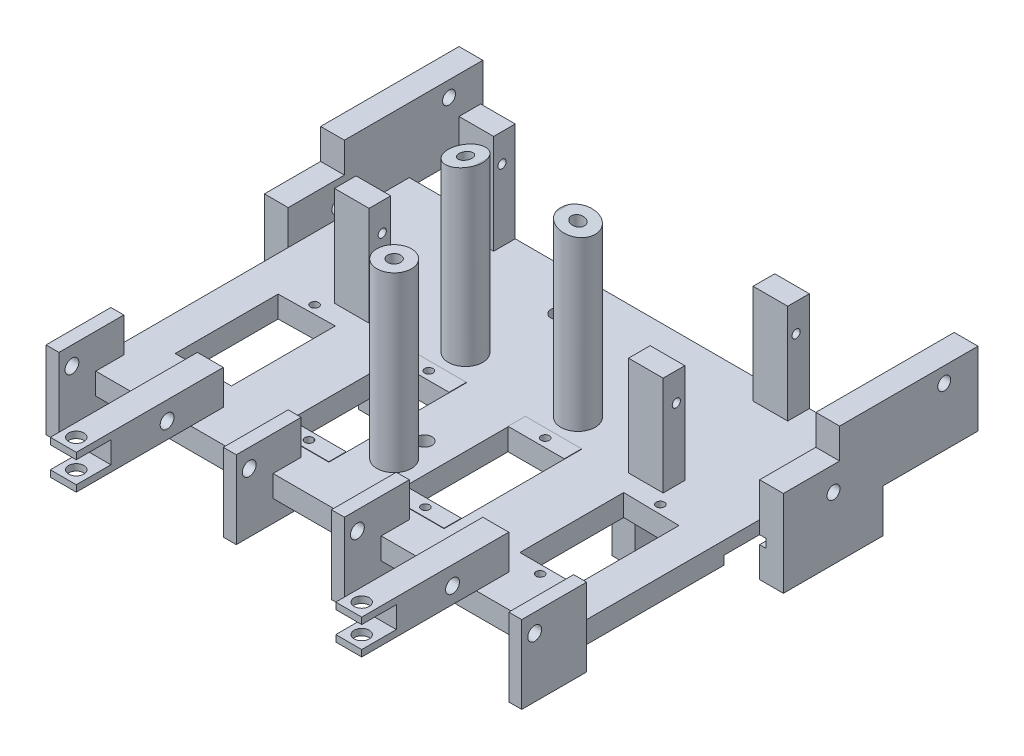
from build123d import *

# Parameters (mm, degrees)
SKETCH_1_W           = 109
SKETCH_1_H           = 75
EXTRUDE_1_DEPTH      = 5
SKETCH_4_W           = 105
SKETCH_4_H           = 28
EXTRUDE_4_DEPTH      = 5
SKETCH_5_W           = 23
SKETCH_5_H           = 20
EXTRUDE_5_DEPTH      = 5.5
SKETCH_6_W           = 32
SKETCH_6_H           = 17
EXTRUDE_6_DEPTH      = 5.5
SKETCH_8_W           = 8
SKETCH_8_H           = 5
EXTRUDE_7_DEPTH      = 23
EXTRUDE_START        = -10
SKETCH_9_W           = 3
SKETCH_9_H           = 15
EXTRUDE_8_DEPTH      = 18
SKETCH_10_W          = 3
SKETCH_10_H          = 15
EXTRUDE_9_DEPTH      = 18
SKETCH_11_W          = 6
SKETCH_11_H          = 34
EXTRUDE_10_DEPTH     = 8
SKETCH_12_R          = 4
EXTRUDE_11_DEPTH     = 40
CUT_EXTRUDE_8_REACH  = 123.15
SKETCH_19_R          = 0.95
SKETCH_25_R          = 4
EXTRUDE_14_DEPTH     = 40
CUT_EXTRUDE_14_DEPTH = 36
SKETCH_28_W          = 6
SKETCH_28_H          = 5
CUT_EXTRUDE_16_DEPTH = 8
SKETCH_29_R          = 1.75
CUT_EXTRUDE_17_DEPTH = 8
SKETCH_30_R          = 1.6
CUT_EXTRUDE_18_DEPTH = 48
SKETCH_31_R          = 1.75
CUT_EXTRUDE_19_DEPTH = 20
SKETCH_35_R          = 1.5
CUT_EXTRUDE_23_DEPTH = 15
SKETCH_36_R          = 0.95
SKETCH_36_W          = 13
SKETCH_36_H          = 23.8
CUT_EXTRUDE_24_DEPTH = 7
SKETCH_37_W          = 6
SKETCH_37_H          = 5
SKETCH_37_W_2        = 5.306431403
EXTRUDE_15_DEPTH     = 13
SKETCH_38_R          = 0.95
CUT_EXTRUDE_25_DEPTH = 13
SKETCH_43_W          = 37.306431403
SKETCH_43_H          = 36.277028663
SKETCH_43_W_2        = 5.306431403
SKETCH_43_H_2        = 5
SKETCH_43_W_3        = 6
CUT_EXTRUDE_28_DEPTH = 2
EXTRUDE_START_2      = 0.1
SKETCH_41_W          = 13
SKETCH_41_H          = 4
SKETCH_41_R          = 0.95
EXTRUDE_16_DEPTH     = 0.1
CUT_EXTRUDE_START    = -13
SKETCH_39_R          = 1.5
CUT_EXTRUDE_26_DEPTH = 55


with BuildPart() as part:
    # 草图1 → 凸台-拉伸1 (new body)
    with BuildSketch(Plane(origin=(0, 0, 0), x_dir=(1, 0, 0), z_dir=(0, 1, 0))):
        Rectangle(SKETCH_1_W, SKETCH_1_H)
    extrude(amount=EXTRUDE_1_DEPTH)

    # 草图4 → 凸台-拉伸4 (add)
    with BuildSketch(Plane(origin=(0, 5, 0), x_dir=(1, 0, 0), z_dir=(0, 1, 0))):
        with Locations((0, 23.5)):
            Rectangle(SKETCH_4_W, SKETCH_4_H)
    extrude(amount=-EXTRUDE_4_DEPTH)

    # 草图5 → 凸台-拉伸5 (add)
    with BuildSketch(Plane.ZY.offset(54.5)):
        with Locations((-21, 3)):
            Rectangle(SKETCH_5_W, SKETCH_5_H)
    extrude_5 = extrude(amount=EXTRUDE_5_DEPTH)

    # 草图6 → 凸台-拉伸6 (add)
    with BuildSketch(Plane.ZY.offset(54.5)):
        with Locations((-38.5, 11.5)):
            Rectangle(SKETCH_6_W, SKETCH_6_H)
    extrude_6 = extrude(amount=EXTRUDE_6_DEPTH)

    # 草图8 → 凸台-拉伸7 (add)
    with BuildSketch(Plane(origin=(0, 5, 0), x_dir=(1, 0, 0), z_dir=(0, 1, 0))):
        with Locations((-34, 35)):
            Rectangle(SKETCH_8_W, SKETCH_8_H)
        with Locations((-34, 6.2)):
            Rectangle(SKETCH_8_W, SKETCH_8_H)
    extrude_7 = extrude(amount=EXTRUDE_7_DEPTH)

    # 草图9 → 凸台-拉伸8 (add)
    with BuildSketch(Plane(origin=(0, 5, 0), x_dir=(1, 0, 0), z_dir=(0, 1, 0)).offset(EXTRUDE_START)):
        with Locations((-12.5, -38.5)):
            Rectangle(SKETCH_9_W, SKETCH_9_H)
    extrude_8 = extrude(amount=EXTRUDE_8_DEPTH)

    # 草图10 → 凸台-拉伸9 (add)
    with BuildSketch(Plane(origin=(0, 5, 0), x_dir=(1, 0, 0), z_dir=(0, 1, 0)).offset(EXTRUDE_START)):
        with Locations((-53.5, -38.5)):
            Rectangle(SKETCH_10_W, SKETCH_10_H)
    extrude_9 = extrude(amount=EXTRUDE_9_DEPTH)

    # 草图11 → 凸台-拉伸10 (add)
    with BuildSketch(Plane(origin=(0, 5, 0), x_dir=(1, 0, 0), z_dir=(0, 1, 0))):
        with Locations((-33, -47)):
            Rectangle(SKETCH_11_W, SKETCH_11_H)
    extrude_10 = extrude(amount=EXTRUDE_10_DEPTH)

    # 草图12 → 凸台-拉伸11 (add)
    with BuildSketch(Plane(origin=(0, 5, 0), x_dir=(1, 0, 0), z_dir=(0, 1, 0))):
        with Locations(Location((-13, 9, 0), (0, 0, 270))):
            Circle(SKETCH_12_R)
    extrude_11 = extrude(amount=EXTRUDE_11_DEPTH)

    # 草图19 → 切除-拉伸8 (cut, up to next)
    with BuildSketch(Plane.ZY.offset(38), mode=Mode.PRIVATE) as cut_extrude_8_sk1:
        with Locations((-6.75, 21.5)):
            Circle(SKETCH_19_R)
    cut_extrude_8_tool1 = extrude(cut_extrude_8_sk1.sketch, amount=-CUT_EXTRUDE_8_REACH, mode=Mode.PRIVATE) & part.part
    # 草图19 → 切除-拉伸8 (cut, up to next)
    with BuildSketch(Plane.ZY.offset(38), mode=Mode.PRIVATE) as cut_extrude_8_sk2:
        with Locations((-34.45, 21.5)):
            Circle(SKETCH_19_R)
    cut_extrude_8_tool2 = extrude(cut_extrude_8_sk2.sketch, amount=-CUT_EXTRUDE_8_REACH, mode=Mode.PRIVATE) & part.part
    cut_extrude_8_1 = cut_extrude_8_tool1.solids().sort_by_distance((-38, 21.5, -6.75))[0]
    add(cut_extrude_8_1, mode=Mode.SUBTRACT)
    cut_extrude_8_2 = cut_extrude_8_tool2.solids().sort_by_distance((-38, 21.5, -34.45))[0]
    add(cut_extrude_8_2, mode=Mode.SUBTRACT)
    cut_extrude_8 = cut_extrude_8_1 + cut_extrude_8_2  # 切除-拉伸8 as one shape, for the pattern or mirror that repeats it

    # 草图25 → 凸台-拉伸14 (add)
    with BuildSketch(Plane(origin=(0, 5, 0), x_dir=(1, 0, 0), z_dir=(0, 1, 0))):
        with Locations(Location((0, -20.5, 0), (0, 0, 270))):
            Circle(SKETCH_25_R)
    extrude(amount=EXTRUDE_14_DEPTH)

    # 草图26 → 切除-拉伸14 (cut)
    with BuildSketch(Plane.XY):
        Polygon((-17, 45), (-17, 43.644045518), (-9.31, 45), align=None)
    cut_extrude_14 = extrude(amount=-CUT_EXTRUDE_14_DEPTH, mode=Mode.SUBTRACT)

    # 草图28 → 切除-拉伸16 (cut)
    with BuildSketch(Plane.XY.offset(64)):
        with Locations((-33, 9)):
            Rectangle(SKETCH_28_W, SKETCH_28_H)
    cut_extrude_16 = extrude(amount=-CUT_EXTRUDE_16_DEPTH, mode=Mode.SUBTRACT)

    # 草图29 → 切除-拉伸17 (cut)
    with BuildSketch(Plane(origin=(0, 13, 0), x_dir=(1, 0, 0), z_dir=(0, 1, 0))):
        with Locations(Location((-33, -61, 0), (0, 0, 270))):
            Circle(SKETCH_29_R)
    cut_extrude_17 = extrude(amount=-CUT_EXTRUDE_17_DEPTH, mode=Mode.SUBTRACT)

    # 草图30 → 切除-拉伸18 (cut)
    with BuildSketch(Plane.ZY.offset(55)):
        with Locations((43, 8.75)):
            Circle(SKETCH_30_R)
    cut_extrude_18 = extrude(amount=-CUT_EXTRUDE_18_DEPTH, mode=Mode.SUBTRACT)

    # 草图31 → 切除-拉伸19 (cut)
    with BuildSketch(Plane(origin=(0, 5, 0), x_dir=(1, 0, 0), z_dir=(0, 1, 0))):
        with Locations(Location((0, -13.5, 0), (0, 0, 270))):
            Circle(SKETCH_31_R)
        with Locations(Location((-10, 27.5, 0), (0, 0, 270))):
            Circle(SKETCH_31_R)
        with Locations(Location((10, 27.5, 0), (0, 0, 270))):
            Circle(SKETCH_31_R)
    extrude(amount=-CUT_EXTRUDE_19_DEPTH, mode=Mode.SUBTRACT)

    # 草图35 → 切除-拉伸23 (cut)
    with BuildSketch(Plane.ZY.offset(60)):
        with Locations((-46.688415906, 16.452713274)):
            Circle(SKETCH_35_R)
        with Locations((-21.089366767, 7.437765567)):
            Circle(SKETCH_35_R)
    cut_extrude_23 = extrude(amount=-CUT_EXTRUDE_23_DEPTH, mode=Mode.SUBTRACT)

    # 草图36 → 切除-拉伸24 (cut)
    with BuildSketch(Plane(origin=(0, 5, 0), x_dir=(1, 0, 0), z_dir=(0, 1, 0))):
        with Locations(Location((-13.450764078, 0.968101862, 0), (0, 0, 270))):
            Circle(SKETCH_36_R)
        with Locations(Location((-13.450764078, -26.731898138, 0), (0, 0, 270))):
            Circle(SKETCH_36_R)
        with Locations(Location((-39.980852572, -26.731898138, 0), (0, 0, 270))):
            Circle(SKETCH_36_R)
        with Locations(Location((-39.98003787, 1.073911603, 0), (0, 0, 270))):
            Circle(SKETCH_36_R)
        with Locations((-13.315810377, -12.881898138)):
            Rectangle(SKETCH_36_W, SKETCH_36_H)
        Polygon((-33.347062743, -0.766375386), (-33.347062743, -24.781898138), (-46.345897091, -24.781898138), (-46.345276079, -0.981898147), align=None)
    cut_extrude_24 = extrude(amount=-CUT_EXTRUDE_24_DEPTH, mode=Mode.SUBTRACT)

    # 草图37 → 凸台-拉伸15 (add)
    with BuildSketch(Plane.XZ):
        with Locations((-29.638562747, -34.522971337)):
            Rectangle(SKETCH_37_W, SKETCH_37_H)
        with Locations((-29.291778449, -5.722971337)):
            Rectangle(SKETCH_37_W_2, SKETCH_37_H)
    extrude_15 = extrude(amount=EXTRUDE_15_DEPTH)

    # 草图38 → 切除-拉伸25 (cut)
    with BuildSketch(Plane.ZY.offset(32.638562747)):
        with Locations((-33.972971337, -4.5)):
            Circle(SKETCH_38_R)
        with Locations((-6.272971337, -4.5)):
            Circle(SKETCH_38_R)
    cut_extrude_25 = extrude(amount=-CUT_EXTRUDE_25_DEPTH, mode=Mode.SUBTRACT)

    # 草图43 → 切除-拉伸28 (cut)
    with BuildSketch(Plane.XZ):
        with Locations((-37.291778449, -19.361485668)):
            Rectangle(SKETCH_43_W, SKETCH_43_H)
        with Locations((-29.291778449, -5.722971337)):
            Rectangle(SKETCH_43_W_2, SKETCH_43_H_2, mode=Mode.SUBTRACT)
        with Locations((-29.638562747, -34.522971337)):
            Rectangle(SKETCH_43_W_3, SKETCH_43_H_2, mode=Mode.SUBTRACT)
    cut_extrude_28 = extrude(amount=-CUT_EXTRUDE_28_DEPTH, mode=Mode.SUBTRACT)

    # 草图41 → 凸台-拉伸16 (add)
    # profile 1 of 2: a face of its own
    with BuildSketch(Plane(origin=(0, 5, 0), x_dir=(1, 0, 0), z_dir=(0, 1, 0)).offset(EXTRUDE_START_2)):
        with Locations((-13.315810377, 1.018101862)):
            Rectangle(SKETCH_41_W, SKETCH_41_H)
        with Locations(Location((-13.450764078, 0.968101862, 0), (0, 0, 270))):
            Circle(SKETCH_41_R, mode=Mode.SUBTRACT)
    # profile 2 of 2: a face of its own
    with BuildSketch(Plane(origin=(0, 5, 0), x_dir=(1, 0, 0), z_dir=(0, 1, 0)).offset(EXTRUDE_START_2)):
        with Locations((-13.315810377, -26.781898138)):
            Rectangle(SKETCH_41_W, SKETCH_41_H)
        with Locations(Location((-13.450764078, -26.731898138, 0), (0, 0, 270))):
            Circle(SKETCH_41_R, mode=Mode.SUBTRACT)
    extrude_16 = extrude(amount=-EXTRUDE_16_DEPTH)

    # 草图39 → 切除-拉伸26 (cut)
    with BuildSketch(Plane(origin=(0, 5, 0), x_dir=(1, 0, 0), z_dir=(0, 1, 0)).offset(CUT_EXTRUDE_START)):
        with Locations(Location((-13, 9, 0), (0, 0, 180))):
            Circle(SKETCH_39_R)
        with Locations(Location((0, -20.5, 0), (0, 0, 270))):
            Circle(SKETCH_39_R)
    cut_extrude_26 = extrude(amount=CUT_EXTRUDE_26_DEPTH, mode=Mode.SUBTRACT)

    # 镜向1: 凸台-拉伸5, 凸台-拉伸6, 凸台-拉伸7, 凸台-拉伸8, 凸台-拉伸9, 凸台-拉伸10, 凸台-拉伸11, 切除-拉伸8, 切除-拉伸14, 切除-拉伸16, 切除-拉伸17, 切除-拉伸18, 切除-拉伸23, 切除-拉伸24, 凸台-拉伸15, 切除-拉伸25, 切除-拉伸28, 凸台-拉伸16, 切除-拉伸26 across plane
    add(extrude_5.mirror(Plane(origin=(0, 0, 0), x_dir=(0, 0, 1), z_dir=(1, 0, 0))))
    add(extrude_6.mirror(Plane(origin=(0, 0, 0), x_dir=(0, 0, 1), z_dir=(1, 0, 0))))
    add(extrude_7.mirror(Plane(origin=(0, 0, 0), x_dir=(0, 0, 1), z_dir=(1, 0, 0))))
    add(extrude_8.mirror(Plane(origin=(0, 0, 0), x_dir=(0, 0, 1), z_dir=(1, 0, 0))))
    add(extrude_9.mirror(Plane(origin=(0, 0, 0), x_dir=(0, 0, 1), z_dir=(1, 0, 0))))
    add(extrude_10.mirror(Plane(origin=(0, 0, 0), x_dir=(0, 0, 1), z_dir=(1, 0, 0))))
    add(extrude_11.mirror(Plane(origin=(0, 0, 0), x_dir=(0, 0, 1), z_dir=(1, 0, 0))))
    add(cut_extrude_8.mirror(Plane(origin=(0, 0, 0), x_dir=(0, 0, 1), z_dir=(1, 0, 0))), mode=Mode.SUBTRACT)
    add(cut_extrude_14.mirror(Plane(origin=(0, 0, 0), x_dir=(0, 0, 1), z_dir=(1, 0, 0))), mode=Mode.SUBTRACT)
    add(cut_extrude_16.mirror(Plane(origin=(0, 0, 0), x_dir=(0, 0, 1), z_dir=(1, 0, 0))), mode=Mode.SUBTRACT)
    add(cut_extrude_17.mirror(Plane(origin=(0, 0, 0), x_dir=(0, 0, 1), z_dir=(1, 0, 0))), mode=Mode.SUBTRACT)
    add(cut_extrude_18.mirror(Plane(origin=(0, 0, 0), x_dir=(0, 0, 1), z_dir=(1, 0, 0))), mode=Mode.SUBTRACT)
    add(cut_extrude_23.mirror(Plane(origin=(0, 0, 0), x_dir=(0, 0, 1), z_dir=(1, 0, 0))), mode=Mode.SUBTRACT)
    add(cut_extrude_24.mirror(Plane(origin=(0, 0, 0), x_dir=(0, 0, 1), z_dir=(1, 0, 0))), mode=Mode.SUBTRACT)
    add(extrude_15.mirror(Plane(origin=(0, 0, 0), x_dir=(0, 0, 1), z_dir=(1, 0, 0))))
    add(cut_extrude_25.mirror(Plane(origin=(0, 0, 0), x_dir=(0, 0, 1), z_dir=(1, 0, 0))), mode=Mode.SUBTRACT)
    add(cut_extrude_28.mirror(Plane(origin=(0, 0, 0), x_dir=(0, 0, 1), z_dir=(1, 0, 0))), mode=Mode.SUBTRACT)
    add(extrude_16.mirror(Plane(origin=(0, 0, 0), x_dir=(0, 0, 1), z_dir=(1, 0, 0))))
    add(cut_extrude_26.mirror(Plane(origin=(0, 0, 0), x_dir=(0, 0, 1), z_dir=(1, 0, 0))), mode=Mode.SUBTRACT)


solid = part.part
